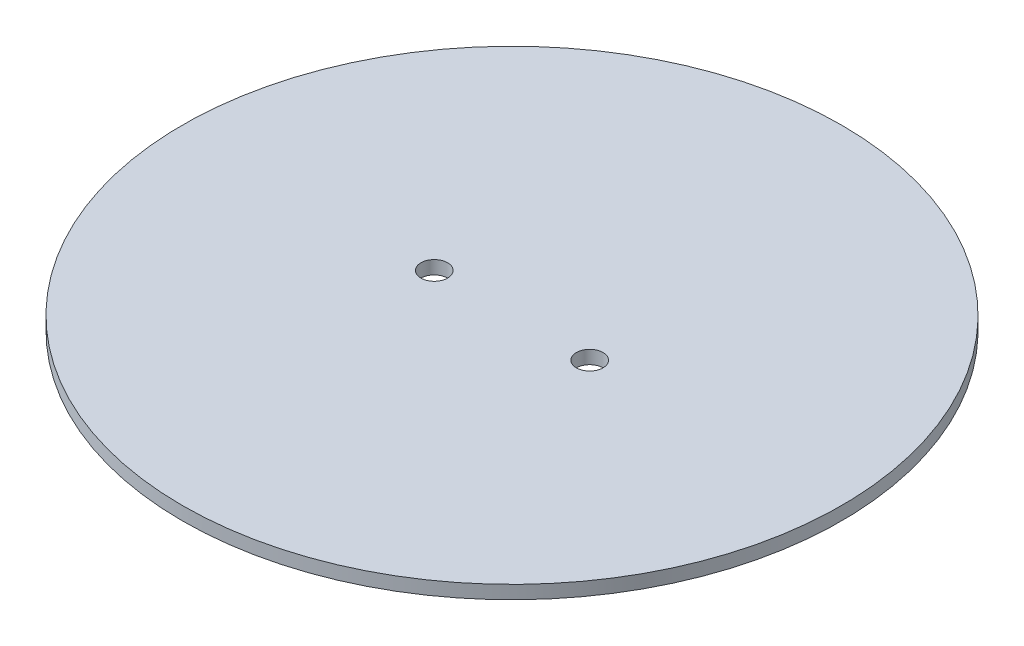
from build123d import *

# Parameters (mm, degrees)
SKETCH1_R           = 74.2
SKETCH1_R_2         = 3
BOSS_EXTRUDE1_DEPTH = 3


with BuildPart() as part:
    # Sketch1 → Boss-Extrude1 (new body)
    with BuildSketch(Plane(origin=(0, 0, 0), x_dir=(1, 0, 0), z_dir=(0, 1, 0))):
        with Locations(Location((0, 0, 0), (0, 0, 270))):
            Circle(SKETCH1_R)
        with Locations(Location((-17.5, 0, 0), (0, 0, 270))):
            Circle(SKETCH1_R_2, mode=Mode.SUBTRACT)
        with Locations(Location((17.5, 0, 0), (0, 0, 270))):
            Circle(SKETCH1_R_2, mode=Mode.SUBTRACT)
    extrude(amount=BOSS_EXTRUDE1_DEPTH)


solid = part.part
